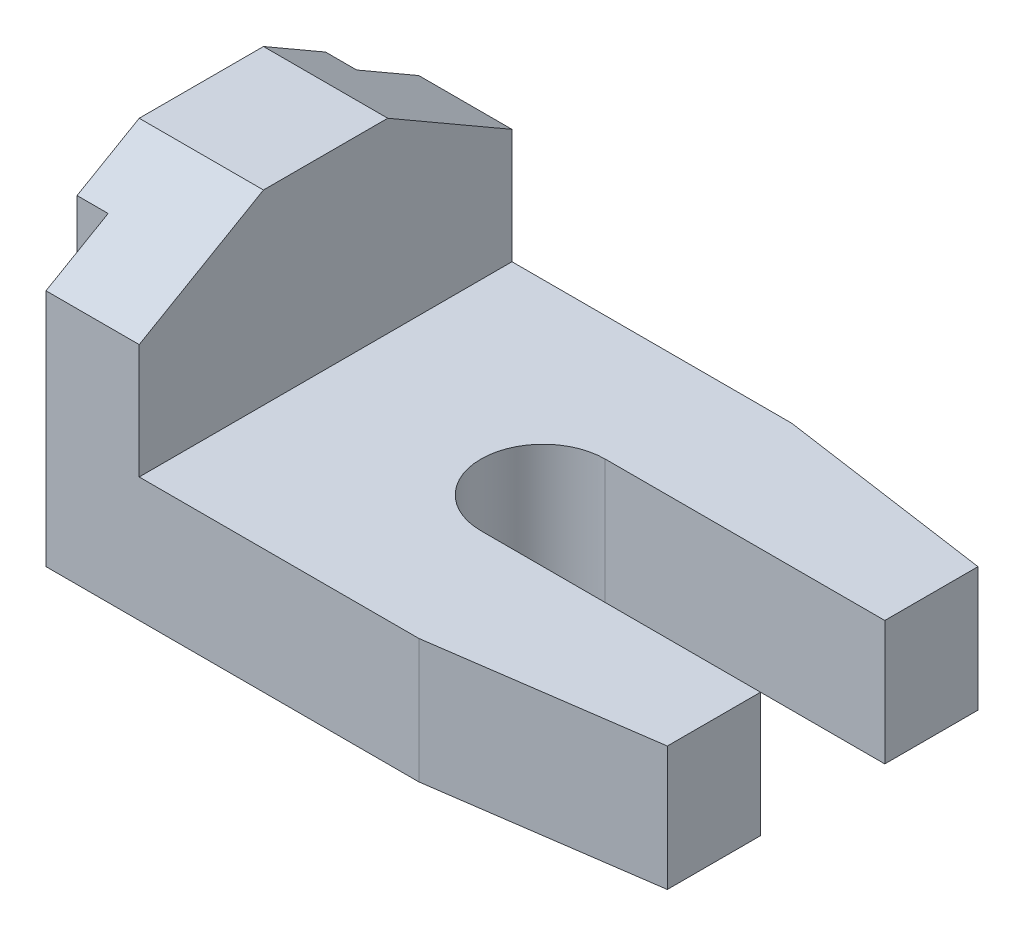
from build123d import *

# Parameters (mm, degrees)
EXTRUDE_1_DEPTH     = 25.4
EXTRUDE_2_DEPTH     = 63.5
CUT_EXTRUDE_1_DEPTH = 63.5


with BuildPart() as part:
    # 草图2 → 凸台-拉伸1 (new body)
    with BuildSketch(Plane(origin=(0, 0, 0), x_dir=(1, 0, 0), z_dir=(0, 1, 0))):
        with BuildLine():
            Line((0, 0), (0, 38.1))
            Line((0, 38.1), (57.15, 38.1))
            Line((57.15, 38.1), (101.6, 31.75))
            Line((101.6, 31.75), (101.6, 12.7))
            Line((101.6, 12.7), (44.45, 12.7))
            ThreePointArc((44.45, 12.7), (31.75, 0), (44.45, -12.7))
            Line((44.45, -12.7), (101.6, -12.7))
            Line((101.6, -12.7), (101.6, -31.75))
            Line((101.6, -31.75), (57.15, -38.1))
            Line((57.15, -38.1), (0, -38.1))
            Line((0, -38.1), (0, 0))
        make_face()
    extrude(amount=EXTRUDE_1_DEPTH)

    # 草图4 → 凸台-拉伸2 (add)
    with BuildSketch(Plane(origin=(0, 0, 0), x_dir=(-1, 0, 0), z_dir=(0, -1, 0))):
        Polygon((0, 38.1), (0, -38.1), (19.05, -38.1), (19.05, -25.4), (25.4, -25.4), (25.4, 25.4), (19.05, 25.4), (19.05, 38.1), align=None)
    extrude(amount=-EXTRUDE_2_DEPTH)

    # 草图5 → 切除-拉伸1 (cut)
    with BuildSketch(Plane(origin=(0, 0, 0), x_dir=(0, 0, -1), z_dir=(1, 0, 0))):
        Polygon((-38.1, 63.5), (-38.1, 48.835303163), (-12.7, 63.5), align=None)
        Polygon((38.1, 63.5), (12.7, 63.5), (38.1, 48.835303163), align=None)
    extrude(amount=-CUT_EXTRUDE_1_DEPTH, mode=Mode.SUBTRACT)


solid = part.part
